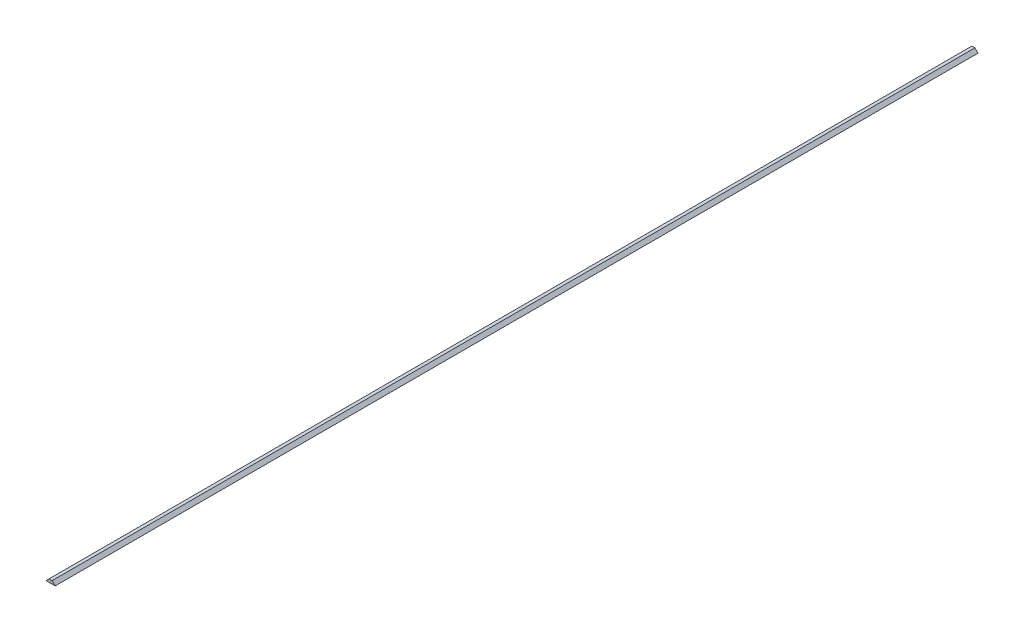
from build123d import *

# Parameters (mm, degrees)
BOSS_EXTRUDE1_DEPTH = 3000


with BuildPart() as part:
    # Sketch1 → Boss-Extrude1 (new body)
    with BuildSketch(Plane.XY):
        Polygon((-15, 0), (15, 0), (5, 10), (-5, 10), align=None)
    extrude(amount=BOSS_EXTRUDE1_DEPTH)


solid = part.part
